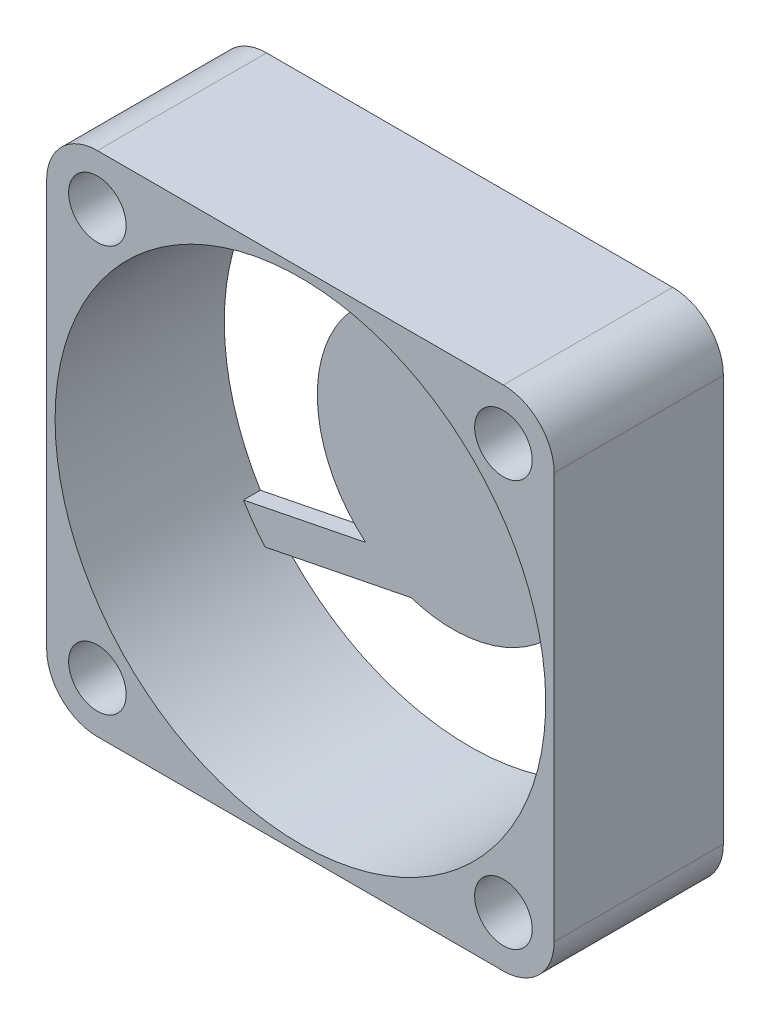
from build123d import *
from build123d.topology import SkipClean

# Parameters (mm, degrees)
BOSS_EXTRU_1_DEPTH      = 10
ENL_V_MAT_EXTRU_1_DEPTH = 9
D_GAGEMENT_M32_D        = 3.4


with BuildPart() as part:
    # Esquisse1 → Boss.-Extru.1 (new body)
    with BuildSketch(Plane.XY.offset(6.5)):
        with BuildLine():
            Line((-12, -15), (12, -15))
            ThreePointArc((12, -15), (14.121320344, -14.121320344), (15, -12))
            Line((15, -12), (15, 12))
            ThreePointArc((15, 12), (14.121320344, 14.121320344), (12, 15))
            Line((12, 15), (-12, 15))
            ThreePointArc((-12, 15), (-14.121320344, 14.121320344), (-15, 12))
            Line((-15, 12), (-15, -12))
            ThreePointArc((-15, -12), (-14.121320344, -14.121320344), (-12, -15))
        make_face()
        with BuildLine():
            Line((6.409501891, -4.787304619), (12.033174962, -8.090284317))
            ThreePointArc((12.033174962, -8.090284317), (0.780346659, -14.478986812), (-11.093944394, -9.336723075))
            Line((-11.093944394, -9.336723075), (-2.459433312, -7.612567752))
            ThreePointArc((-2.459433312, -7.612567752), (2.428227417, -7.622579066), (6.409501891, -4.787304619))
        make_face(mode=Mode.SUBTRACT)
        with BuildLine():
            Line((12.979808931, -6.463324231), (7.350678361, -3.157139153))
            ThreePointArc((7.350678361, -3.157139153), (6.92820323, 4), (0.941176471, 7.944443772))
            Line((0.941176471, 7.944443772), (0.941176471, 14.469422478))
            ThreePointArc((0.941176471, 14.469422478), (12.56954374, 7.228870601), (12.979808931, -6.463324231))
        make_face(mode=Mode.SUBTRACT)
        with BuildLine():
            Line((-5.143653135, -6.127220612), (-12.367309381, -7.569653802))
            ThreePointArc((-12.367309381, -7.569653802), (-12.874431786, 6.670757541), (-0.948221665, 14.468962495))
            Line((-0.948221665, 14.468962495), (-0.948221665, 7.943605962))
            ThreePointArc((-0.948221665, 7.943605962), (-7.666470815, 2.285875158), (-5.143653135, -6.127220612))
        make_face(mode=Mode.SUBTRACT)
    extrude(amount=-BOSS_EXTRU_1_DEPTH)

    # Esquisse2 → Enlèv. mat.-Extru.1 (cut)
    with SkipClean():  # the faces are left unmerged after this step: merging them gives an invalid solid
        with BuildSketch(Plane.XY.offset(6.5)):
            with BuildLine():
                Line((-11.093944394, -9.336723075), (-2.459433312, -7.612567752))
                ThreePointArc((-2.459433312, -7.612567752), (2.428227417, -7.622579066), (6.409501891, -4.787304619))
                Line((6.409501891, -4.787304619), (12.033174962, -8.090284317))
                ThreePointArc((12.033174962, -8.090284317), (12.532920274, -7.292181389), (12.979808931, -6.463324231))
                Line((12.979808931, -6.463324231), (7.350678361, -3.157139153))
                ThreePointArc((7.350678361, -3.157139153), (6.92820323, 4), (0.941176471, 7.944443772))
                Line((0.941176471, 7.944443772), (0.941176471, 14.469422478))
                ThreePointArc((0.941176471, 14.469422478), (-0.003530097, 14.49999957), (-0.948221665, 14.468962495))
                Line((-0.948221665, 14.468962495), (-0.948221665, 7.943605962))
                ThreePointArc((-0.948221665, 7.943605962), (-7.666470815, 2.285875158), (-5.143653135, -6.127220612))
                Line((-5.143653135, -6.127220612), (-12.367309381, -7.569653802))
                ThreePointArc((-12.367309381, -7.569653802), (-11.763853137, -8.477131553), (-11.093944394, -9.336723075))
            make_face()
        extrude(amount=-ENL_V_MAT_EXTRU_1_DEPTH, mode=Mode.SUBTRACT)

    # Dégagement M32 (through all)
    with Locations(Plane.XY.offset(6.5)):
        with Locations((-12, 12), (-12, -12), (12, -12), (12, 12)):
            Hole(D_GAGEMENT_M32_D / 2)


solid = part.part
